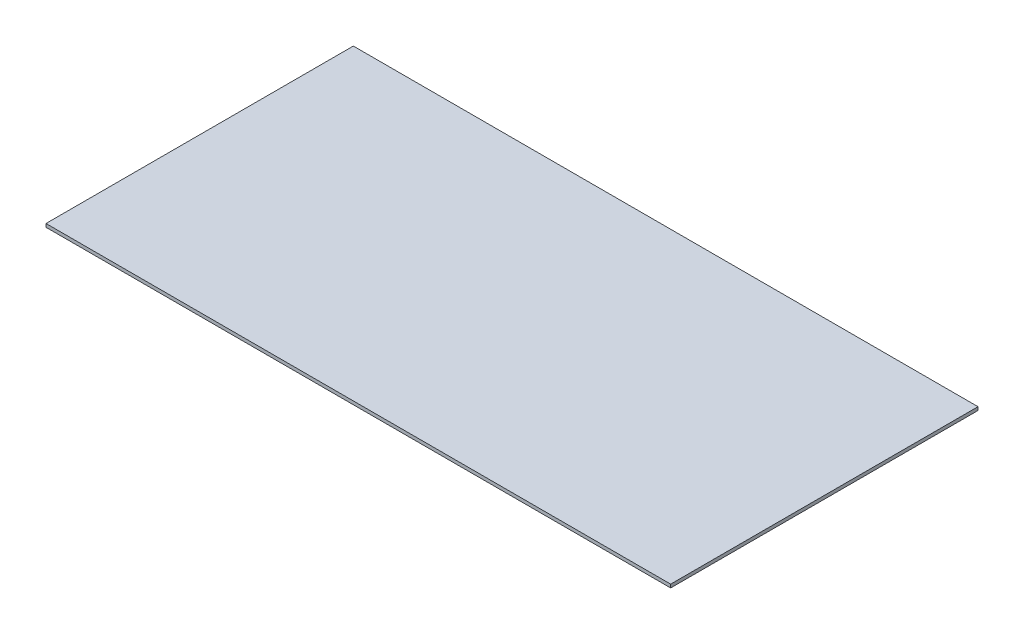
from build123d import *

# Parameters (mm, degrees)
SKETCH1_W           = 563
SKETCH1_H           = 277
BOSS_EXTRUDE1_DEPTH = 3


with BuildPart() as part:
    # Sketch1 → Boss-Extrude1 (new body)
    with BuildSketch(Plane(origin=(0, 0, 0), x_dir=(1, 0, 0), z_dir=(0, 1, 0))):
        with Locations((281.5, 138.5)):
            Rectangle(SKETCH1_W, SKETCH1_H)
    extrude(amount=BOSS_EXTRUDE1_DEPTH)


solid = part.part
